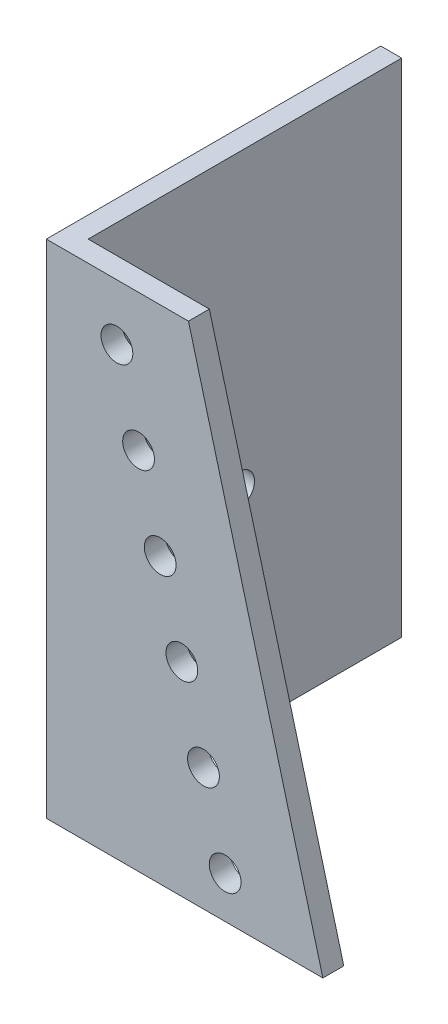
from build123d import *

# Parameters (mm, degrees)
BOSS_EXTRUDE1_DEPTH = 76.2
SKETCH2_R           = 2.413
CUT_EXTRUDE1_DEPTH  = 104.224128115
SKETCH3_R           = 2.413
CUT_EXTRUDE2_DEPTH  = 100.4739202


with BuildPart() as part:
    # Sketch1 → Boss-Extrude1 (new body)
    with BuildSketch(Plane(origin=(0, 0, 0), x_dir=(1, 0, 0), z_dir=(0, 1, 0))):
        Polygon((0, 0), (0, 50.8), (3.175, 50.8), (3.175, 3.175), (50.8, 3.175), (50.8, 0), align=None)
    extrude(amount=BOSS_EXTRUDE1_DEPTH)

    # Sketch2 → Cut-Extrude1 (cut, through all)
    with BuildSketch(Plane(origin=(0, 0, -3.175), x_dir=(-1, 0, 0), z_dir=(0, 0, -1))):
        with Locations((-27.1582436, 6.35)):
            Circle(SKETCH2_R)
        with Locations((-23.871241727, 18.617257994)):
            Circle(SKETCH2_R)
        with Locations((-20.584239855, 30.884515988)):
            Circle(SKETCH2_R)
        with Locations((-17.297237982, 43.151773982)):
            Circle(SKETCH2_R)
        with Locations((-14.010236109, 55.419031975)):
            Circle(SKETCH2_R)
        with Locations((-10.723234236, 67.686289969)):
            Circle(SKETCH2_R)
        Polygon((-21.59, 76.2), (-50.8, -32.813204089), (-50.8, 76.2), align=None)
    extrude(amount=-CUT_EXTRUDE1_DEPTH, mode=Mode.SUBTRACT)

    # Sketch3 → Cut-Extrude2 (cut, through all)
    with BuildSketch(Plane(origin=(3.175, 0, 0), x_dir=(0, 0, -1), z_dir=(1, 0, 0))):
        with Locations((13.335, 6.35)):
            Circle(SKETCH3_R)
        with Locations((26.035, 6.35)):
            Circle(SKETCH3_R)
        with Locations((13.335, 19.05)):
            Circle(SKETCH3_R)
        with Locations((26.035, 19.05)):
            Circle(SKETCH3_R)
        with Locations((13.335, 31.75)):
            Circle(SKETCH3_R)
        with Locations((26.035, 31.75)):
            Circle(SKETCH3_R)
    extrude(amount=-CUT_EXTRUDE2_DEPTH, mode=Mode.SUBTRACT)


solid = part.part
